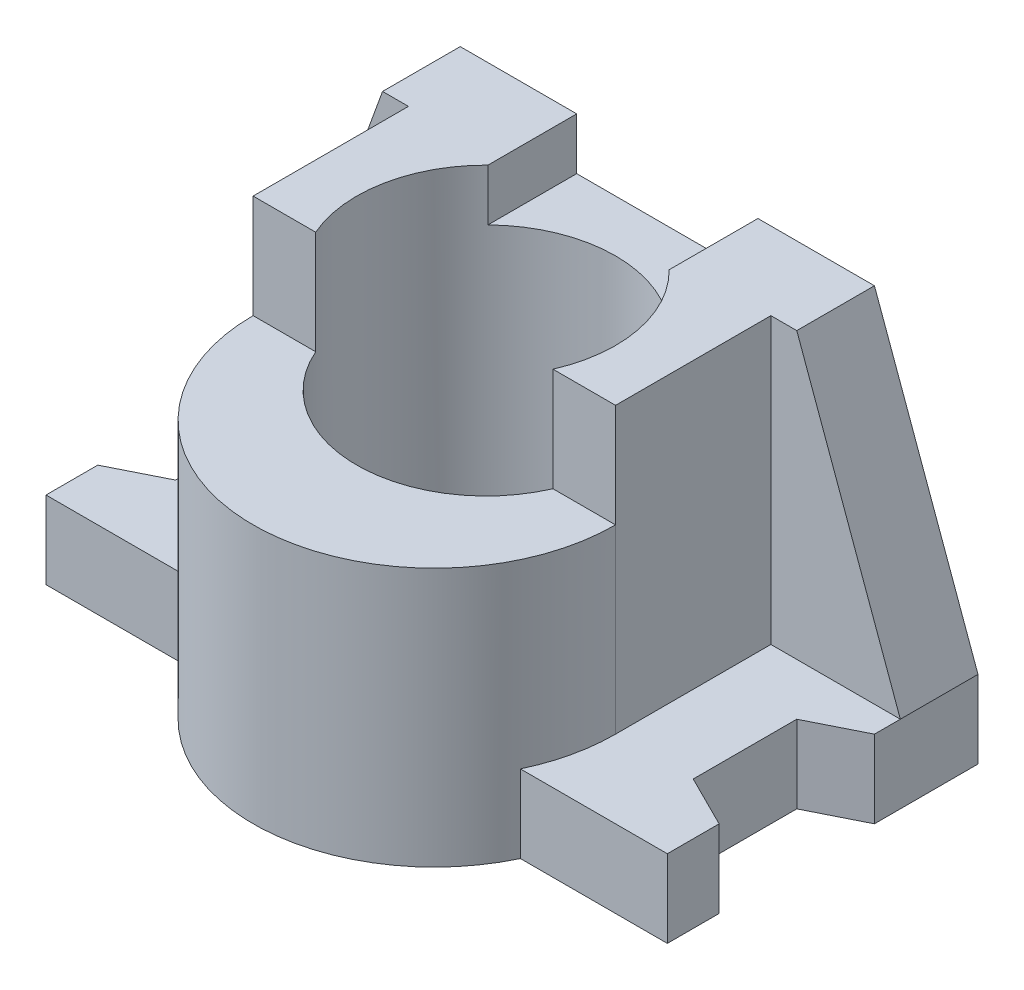
from build123d import *

# Parameters (mm, degrees)
BOSS_EXTRUDE1_DEPTH   = 15
BOSS_EXTRUDE1_2_DEPTH = 15
BOSS_EXTRUDE2_DEPTH   = 50
BOSS_EXTRUDE3_DEPTH   = 70
BOSS_EXTRUDE4_DEPTH   = 60
BOSS_EXTRUDE5_DEPTH   = 15


with BuildPart() as part:
    # Sketch1 → Boss-Extrude1 (new body)
    with BuildSketch(Plane(origin=(0, 0, 0), x_dir=(1, 0, 0), z_dir=(0, 1, 0))):
        with BuildLine():
            ThreePointArc((-31.622776602, -37.725821986), (-34.145257219, -30.413566094), (-35, -22.725821986))
            Line((-35, -22.725821986), (-35, 7.274178014))
            Line((-35, 7.274178014), (-40, 7.274178014))
            Line((-40, 7.274178014), (-40, 22.274178014))
            Line((-40, 22.274178014), (-60, 22.274178014))
            Line((-60, 22.274178014), (-60, 2.274178014))
            Line((-60, 2.274178014), (-50, -2.725821986))
            Line((-50, -2.725821986), (-50, -22.725821986))
            Line((-50, -22.725821986), (-60, -27.725821986))
            Line((-60, -27.725821986), (-60, -37.725821986))
            Line((-60, -37.725821986), (-31.622776602, -37.725821986))
        make_face()
    extrude(amount=BOSS_EXTRUDE1_DEPTH)



with BuildPart() as body_2:
    # Sketch1 → Boss-Extrude1 2 (new body)
    with BuildSketch(Plane(origin=(0, 0, 0), x_dir=(1, 0, 0), z_dir=(0, 1, 0))):
        with BuildLine():
            ThreePointArc((35, -22.725821986), (34.145257219, -30.413566094), (31.622776602, -37.725821986))
            Line((31.622776602, -37.725821986), (60, -37.725821986))
            Line((60, -37.725821986), (60, -27.725821986))
            Line((60, -27.725821986), (50, -22.725821986))
            Line((50, -22.725821986), (50, -2.725821986))
            Line((50, -2.725821986), (60, 2.274178014))
            Line((60, 2.274178014), (60, 22.274178014))
            Line((60, 22.274178014), (40, 22.274178014))
            Line((40, 22.274178014), (40, 7.274178014))
            Line((40, 7.274178014), (35, 7.274178014))
            Line((35, 7.274178014), (35, -22.725821986))
        make_face()
    extrude(amount=BOSS_EXTRUDE1_2_DEPTH)


with BuildPart() as part_1:
    add(part.part)

    add(body_2.part)  # Boss-Extrude2 merges body 2
    # Sketch1<3> → Boss-Extrude2 (add)
    with BuildSketch(Plane(origin=(0, 0, 0), x_dir=(1, 0, 0), z_dir=(0, 1, 0))):
        with BuildLine():
            Line((-22.912878475, -22.725821986), (-35, -22.725821986))
            ThreePointArc((-35, -22.725821986), (0, -57.725821986), (35, -22.725821986))
            Line((35, -22.725821986), (22.912878475, -22.725821986))
            ThreePointArc((22.912878475, -22.725821986), (0, -37.725821986), (-22.912878475, -22.725821986))
        make_face()
    extrude(amount=BOSS_EXTRUDE2_DEPTH)

    # Sketch1<4> → Boss-Extrude3 (add)
    with BuildSketch(Plane(origin=(0, 0, 0), x_dir=(1, 0, 0), z_dir=(0, 1, 0))):
        with BuildLine():
            Line((-35, 7.274178014), (-35, -22.725821986))
            Line((-35, -22.725821986), (-22.912878475, -22.725821986))
            ThreePointArc((-22.912878475, -22.725821986), (-24.540895298, -7.956706975), (-17.5, 5.127749085))
            Line((-17.5, 5.127749085), (-17.5, 22.274178014))
            Line((-17.5, 22.274178014), (-40, 22.274178014))
            Line((-40, 22.274178014), (-40, 7.274178014))
            Line((-40, 7.274178014), (-35, 7.274178014))
        make_face()
        with BuildLine():
            ThreePointArc((17.5, 5.127749085), (24.540895298, -7.956706975), (22.912878475, -22.725821986))
            Line((22.912878475, -22.725821986), (35, -22.725821986))
            Line((35, -22.725821986), (35, 7.274178014))
            Line((35, 7.274178014), (40, 7.274178014))
            Line((40, 7.274178014), (40, 22.274178014))
            Line((40, 22.274178014), (17.5, 22.274178014))
            Line((17.5, 22.274178014), (17.5, 5.127749085))
        make_face()
    extrude(amount=BOSS_EXTRUDE3_DEPTH)

    # Sketch1<5> → Boss-Extrude4 (add)
    with BuildSketch(Plane(origin=(0, 0, 0), x_dir=(1, 0, 0), z_dir=(0, 1, 0))):
        with BuildLine():
            Line((-17.5, 22.274178014), (-17.5, 5.127749085))
            ThreePointArc((-17.5, 5.127749085), (0, 12.274178014), (17.5, 5.127749085))
            Line((17.5, 5.127749085), (17.5, 22.274178014))
            Line((17.5, 22.274178014), (-17.5, 22.274178014))
        make_face()
    extrude(amount=BOSS_EXTRUDE4_DEPTH)

    # Sketch3 → Boss-Extrude5 (add)
    with BuildSketch(Plane(origin=(0, 0, -22.274178014), x_dir=(-1, 0, 0), z_dir=(0, 0, -1))):
        Polygon((60, 15), (40, 15), (40, 70), align=None)
        Polygon((-60, 15), (-40, 15), (-40, 70), align=None)
    extrude(amount=-BOSS_EXTRUDE5_DEPTH)


solid = part_1.part
